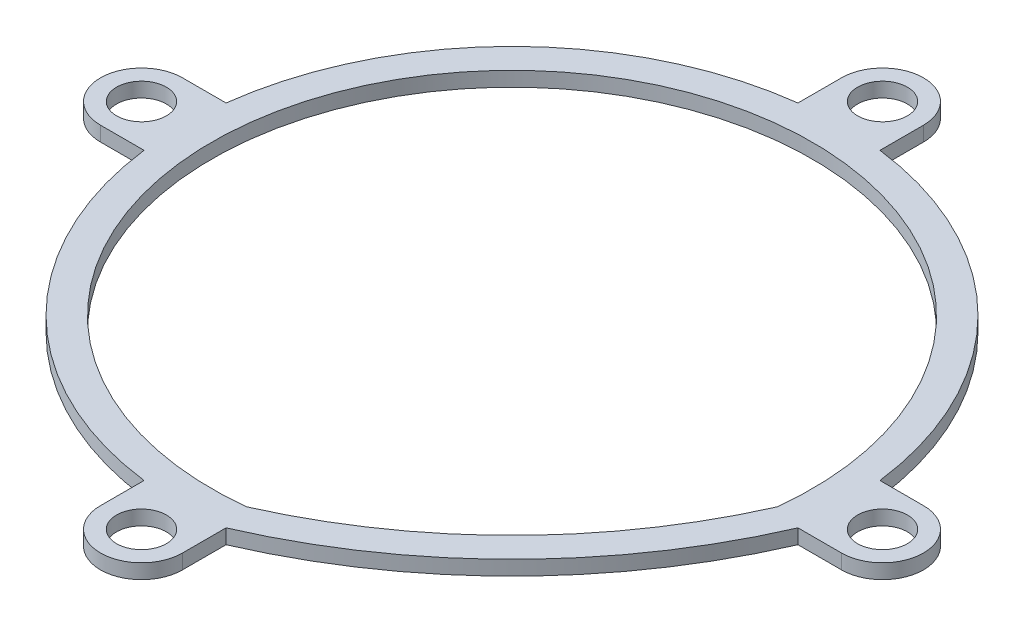
from build123d import *

# Parameters (mm, degrees)
EXTRUDE_1_DEPTH   = 1
HOLE_WIZARD_M31_D = 3.4


with BuildPart() as part:
    # Эскиз1 → Бобышка-Вытянуть1 (new body)
    with BuildSketch(Plane(origin=(0, 0, 0), x_dir=(1, 0, 0), z_dir=(0, 1, 0))):
        with BuildLine():
            Line((22.325097984, -2.8), (25.3, -2.8))
            ThreePointArc((25.3, -2.8), (28.1, 0), (25.3, 2.8))
            Line((25.3, 2.8), (22.325097984, 2.8))
            ThreePointArc((22.325097984, 2.8), (15.909902577, 15.909902577), (2.8, 22.325097984))
            Line((2.8, 22.325097984), (2.8, 25.3))
            ThreePointArc((2.8, 25.3), (0, 28.1), (-2.8, 25.3))
            Line((-2.8, 25.3), (-2.8, 22.325097984))
            ThreePointArc((-2.8, 22.325097984), (-15.909902577, 15.909902577), (-22.325097984, 2.8))
            Line((-22.325097984, 2.8), (-25.3, 2.8))
            ThreePointArc((-25.3, 2.8), (-28.1, 0), (-25.3, -2.8))
            Line((-25.3, -2.8), (-22.325097984, -2.8))
            ThreePointArc((-22.325097984, -2.8), (-15.909902577, -15.909902577), (-2.8, -22.325097984))
            Line((-2.8, -22.325097984), (-2.8, -25.3))
            ThreePointArc((-2.8, -25.3), (0, -28.1), (2.8, -25.3))
            Line((2.8, -25.3), (2.8, -22.325097984))
            ThreePointArc((2.8, -22.325097984), (14.4243682, -14.4243682), (22.325097984, -2.8))
        make_face()
        with BuildLine():
            ThreePointArc((20.373939602, -2.269930633), (-14.495689014, 14.495689014), (2.269930633, -20.373939602))
            ThreePointArc((2.269930633, -20.373939602), (13.010154638, -13.010154638), (20.373939602, -2.269930633))
        make_face(mode=Mode.SUBTRACT)
    extrude(amount=EXTRUDE_1_DEPTH)

    # Отверстие с зазором M31 (through all)
    with Locations(Plane(origin=(0, 1, 0), x_dir=(1, 0, 0), z_dir=(0, 1, 0))):
        with Locations((-25.3, 0), (0, 25.3), (25.3, 0), (0, -25.3)):
            Hole(HOLE_WIZARD_M31_D / 2)


solid = part.part
